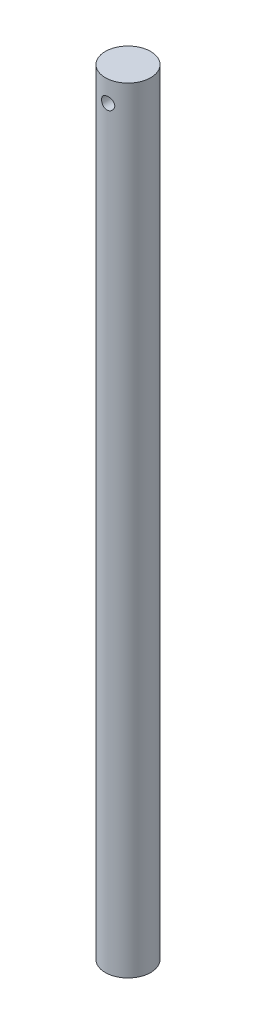
from build123d import *

# Parameters (mm, degrees)
SKETCH_1_R         = 15
EXTRUDE_1_DEPTH    = 512
SKETCH1_R          = 4
CUT_EXTRUDE1_DEPTH = 516.437460441


with BuildPart() as part:
    # Эскиз1 → Вытянуть1 (new body)
    with BuildSketch(Plane(origin=(0, 0, 0), x_dir=(1, 0, 0), z_dir=(0, 1, 0))):
        with Locations(Location((0, 0, 0), (0, 0, 270))):
            Circle(SKETCH_1_R)
    extrude(amount=EXTRUDE_1_DEPTH)

    # Sketch1 → Cut-Extrude1 (cut, through all)
    with BuildSketch(Plane.XY.offset(42.504570482)):
        with Locations((1.307704956, 498)):
            Circle(SKETCH1_R)
    extrude(amount=-CUT_EXTRUDE1_DEPTH, mode=Mode.SUBTRACT)


solid = part.part
